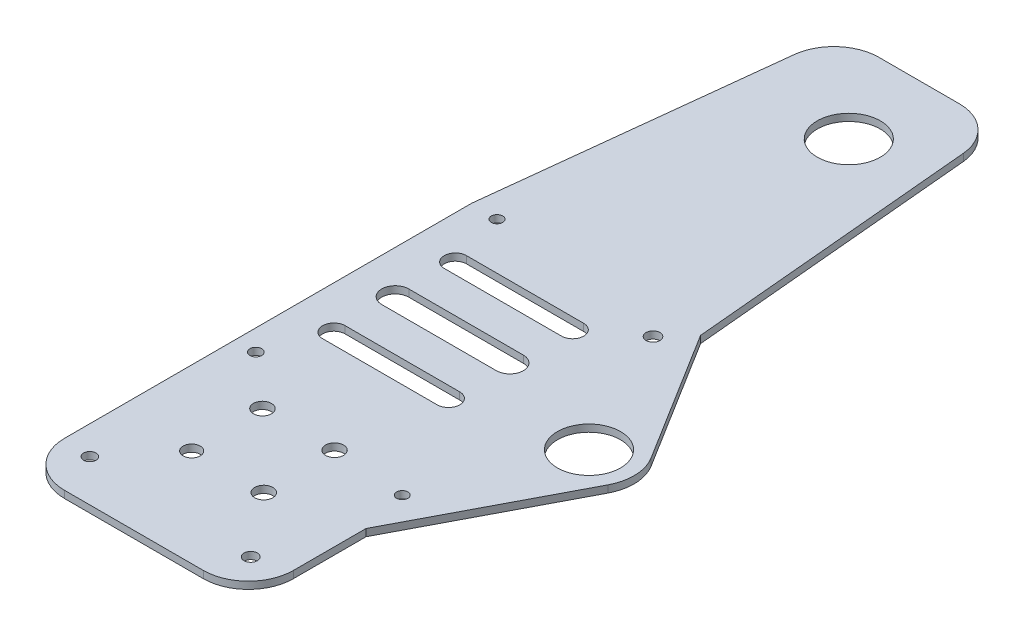
from build123d import *

# Parameters (mm, degrees)
SKETCH1_R           = 1.388229101
SKETCH1_R_2         = 1.896979128
SKETCH1_R_3         = 2
SKETCH1_R_4         = 1.314910669
SKETCH1_R_5         = 1.483383261
SKETCH1_R_6         = 1.248623853
SKETCH1_R_7         = 1.255629307
SKETCH1_R_8         = 7
SKETCH1_R_9         = 1.53911217
BOSS_EXTRUDE1_DEPTH = 1.5875
SKETCH4_W           = 66.272407177
SKETCH4_H           = 27.800260981
CUT_EXTRUDE2_DEPTH  = 20
FILLET3_R           = 10
FILLET4_R           = 10
BOSS_EXTRUDE3_START = -1.5875
BOSS_EXTRUDE3_DEPTH = 1.5875
SKETCH7_R           = 7
CUT_EXTRUDE3_DEPTH  = 1.5875
SKETCH8_W           = 100.106183873
SKETCH8_H           = 60.21728362
CUT_EXTRUDE4_DEPTH  = 35
FILLET5_R           = 10


with BuildPart() as part:
    # Sketch1 → Boss-Extrude1 (new body)
    with BuildSketch(Plane(origin=(0, 0, 0), x_dir=(1, 0, 0), z_dir=(0, 1, 0))):
        with BuildLine():
            Line((42.32729629, 228.6), (10.454309325, 228.6))
            Line((10.454309325, 228.6), (0, 135.362739137))
            Line((0, 135.362739137), (0, 0))
            Line((0, 0), (24.327009544, 0))
            Line((24.327009544, 0), (50.8, 0))
            Line((50.8, 0), (50.8, 64.87909603))
            Line((50.8, 64.87909603), (50.8, 87.423477361))
            Line((50.8, 87.423477361), (50.8, 98.200996728))
            ThreePointArc((50.8, 98.200996728), (50.4, 101.000996728), (50.8, 103.800996728))
            Line((50.8, 103.800996728), (50.8, 104.488200565))
            Line((50.8, 104.488200565), (50.8, 120.619222808))
            Line((50.8, 120.619222808), (50.8, 135.362739137))
            Line((50.8, 135.362739137), (42.32729629, 228.6))
        make_face()
        with Locations(Location((6.335590122, 44.288799513, 0), (0, 0, 270))):
            Circle(SKETCH1_R, mode=Mode.SUBTRACT)
        with Locations(Location((16.545548495, 56.66670766, 0), (0, 0, 270))):
            Circle(SKETCH1_R_2, mode=Mode.SUBTRACT)
        with Locations(Location((32.542900948, 56.67, 0), (0, 0, 270))):
            Circle(SKETCH1_R_3, mode=Mode.SUBTRACT)
        with Locations(Location((4.659546827, 82.793173401, 0), (0, 0, 270))):
            Circle(SKETCH1_R_4, mode=Mode.SUBTRACT)
        with Locations(Location((16.254490953, 72.66670766, 0), (0, 0, 270))):
            Circle(SKETCH1_R_3, mode=Mode.SUBTRACT)
        with Locations(Location((32.251843406, 72.67, 0), (0, 0, 270))):
            Circle(SKETCH1_R_3, mode=Mode.SUBTRACT)
        with BuildLine():
            Line((34.925740903, 92.78493524), (9.492033273, 92.78493524))
            ThreePointArc((9.492033273, 92.78493524), (6.992033273, 95.28493524), (9.492033273, 97.78493524))
            Line((9.492033273, 97.78493524), (34.925740903, 97.78493524))
            ThreePointArc((34.925740903, 97.78493524), (36.693507856, 97.052702193), (37.425740903, 95.28493524))
            ThreePointArc((37.425740903, 95.28493524), (36.693507856, 93.517168287), (34.925740903, 92.78493524))
        make_face(mode=Mode.SUBTRACT)
        with BuildLine():
            Line((34.925740903, 105.90993524), (9.492033273, 105.90993524))
            ThreePointArc((9.492033273, 105.90993524), (6.492033273, 108.90993524), (9.492033273, 111.90993524))
            Line((9.492033273, 111.90993524), (34.925740903, 111.90993524))
            ThreePointArc((34.925740903, 111.90993524), (37.047061246, 111.031255584), (37.925740903, 108.90993524))
            ThreePointArc((37.925740903, 108.90993524), (37.047061246, 106.788614896), (34.925740903, 105.90993524))
        make_face(mode=Mode.SUBTRACT)
        with Locations(Location((43.447673368, 42.868436544, 0), (0, 0, 270))):
            Circle(SKETCH1_R_5, mode=Mode.SUBTRACT)
        with Locations(Location((48.400988852, 71.551011715, 0), (0, 0, 270))):
            Circle(SKETCH1_R_6, mode=Mode.SUBTRACT)
        with Locations(Location((5.88467603, 135.103145298, 0), (0, 0, 270))):
            Circle(SKETCH1_R_7, mode=Mode.SUBTRACT)
        with BuildLine():
            Line((35.509675341, 119.784935244), (9.492033273, 119.784935244))
            ThreePointArc((9.492033273, 119.784935244), (7.026609419, 122.250359097), (9.492033273, 124.71578295))
            Line((9.492033273, 124.71578295), (35.509675341, 124.71578295))
            ThreePointArc((35.509675341, 124.71578295), (37.252993266, 123.993677022), (37.975099194, 122.250359097))
            ThreePointArc((37.975099194, 122.250359097), (37.252993266, 120.507041172), (35.509675341, 119.784935244))
        make_face(mode=Mode.SUBTRACT)
        with Locations(Location((29.504213454, 189.557234372, 0), (0, 0, 270))):
            Circle(SKETCH1_R_8, mode=Mode.SUBTRACT)
        with Locations(Location((45.747747887, 129.863467374, 0), (0, 0, 270))):
            Circle(SKETCH1_R_9, mode=Mode.SUBTRACT)
    extrude(amount=BOSS_EXTRUDE1_DEPTH)

    # Sketch4 → Cut-Extrude2 (cut)
    with BuildSketch(Plane(origin=(0, 0, -228.6), x_dir=(-1, 0, 0), z_dir=(0, 0, -1))):
        with Locations((-28.174690156, -1.980940155)):
            Rectangle(SKETCH4_W, SKETCH4_H)
    extrude(amount=-CUT_EXTRUDE2_DEPTH, mode=Mode.SUBTRACT)

    # Fillet3
    fillet3_edges = [part.edges().sort_by_distance(p)[0] for p in [
        (44.144746445, 0.79375, -208.6),
    ]]
    fillet(fillet3_edges, radius=FILLET3_R)

    # Fillet4
    fillet4_edges = [part.edges().sort_by_distance(p)[0] for p in [
        (50.8, 0.79375, 0),
        (0, 0.79375, 0),
        (8.211791854, 0.79375, -208.6),
    ]]
    fillet(fillet4_edges, radius=FILLET4_R)

    # Sketch6 → Boss-Extrude3 (add)
    with BuildSketch(Plane(origin=(0, 1.5875, 0), x_dir=(1, 0, 0), z_dir=(0, 1, 0)).offset(BOSS_EXTRUDE3_START)):
        with BuildLine():
            Line((50.8, 135.362739137), (50.8, 103.800996728))
            ThreePointArc((50.8, 103.800996728), (50.4, 101.000996728), (50.8, 98.200996728))
            Line((50.8, 98.200996728), (50.8, 61.124243317))
            Line((50.8, 61.124243317), (69.258211507, 96.360728536))
            ThreePointArc((69.258211507, 96.360728536), (70.393157133, 101.370875786), (68.890940865, 106.283413148))
            Line((68.890940865, 106.283413148), (50.8, 135.362739137))
        make_face()
    extrude(amount=BOSS_EXTRUDE3_DEPTH)

    # Sketch7 → Cut-Extrude3 (cut)
    with BuildSketch(Plane(origin=(0, 1.5875, 0), x_dir=(1, 0, 0), z_dir=(0, 1, 0))):
        with Locations(Location((60.4, 101.000996728, 0), (0, 0, 270))):
            Circle(SKETCH7_R)
    extrude(amount=-CUT_EXTRUDE3_DEPTH, mode=Mode.SUBTRACT)

    # Sketch8 → Cut-Extrude4 (cut)
    with BuildSketch(Plane.XY):
        with Locations((28.455154517, 1.704032249)):
            Rectangle(SKETCH8_W, SKETCH8_H)
    extrude(amount=-CUT_EXTRUDE4_DEPTH, mode=Mode.SUBTRACT)

    # Fillet5
    fillet5_edges = [part.edges().sort_by_distance(p)[0] for p in [
        (0, 0.79375, -35),
        (50.8, 0.79375, -35),
    ]]
    fillet(fillet5_edges, radius=FILLET5_R)


solid = part.part
